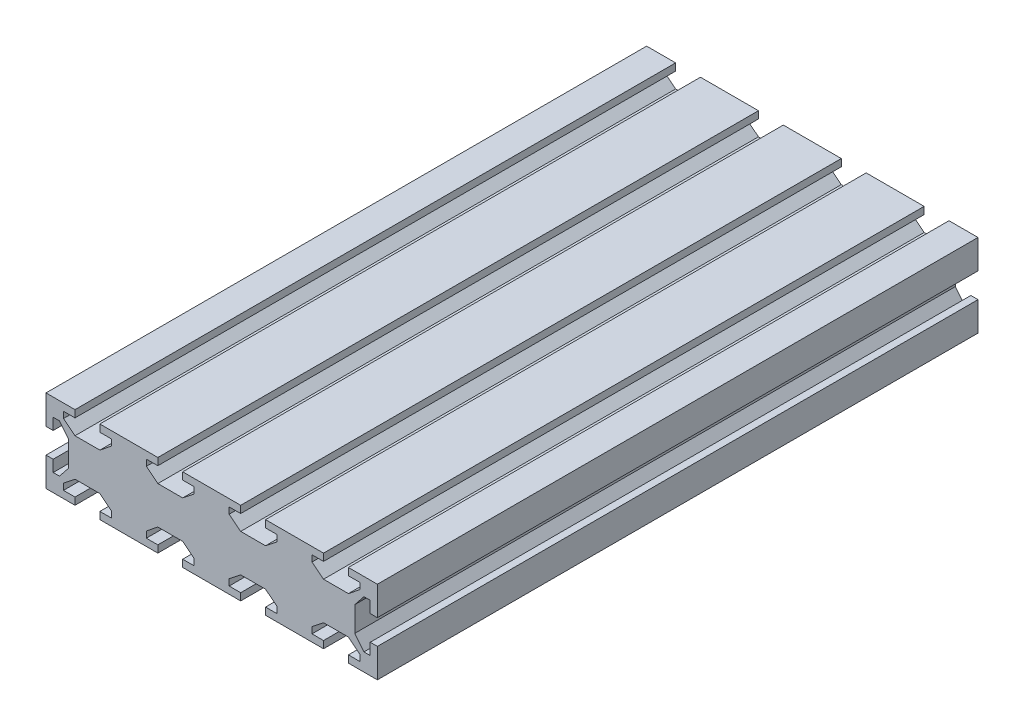
from build123d import *

# Parameters (mm, degrees)
BOSS_EXTRUDE1_DEPTH = 72.5


with BuildPart() as part:
    # Sketch1 → Boss-Extrude1 (new, symmetric)
    with BuildSketch(Plane.XY):
        Polygon((-10, 3), (-10, 10), (-3, 10), (-3, 8.27), (-5.78, 8.27), (-5.78, 6.75), (-3, 4.542263603), (3, 4.542263603), (5.78, 6.75), (5.78, 8.27), (3, 8.27), (3, 10), (10, 10), (17, 10), (17, 8.27), (14.22, 8.27), (14.22, 6.75), (17, 4.542263603), (23, 4.542263603), (25.78, 6.75), (25.78, 8.27), (23, 8.27), (23, 10), (30, 10), (37, 10), (37, 8.27), (34.22, 8.27), (34.22, 6.75), (37, 4.542263603), (43, 4.542263603), (45.78, 6.75), (45.78, 8.27), (43, 8.27), (43, 10), (50, 10), (57, 10), (57, 8.27), (54.22, 8.27), (54.22, 6.75), (57, 4.542263603), (63, 4.542263603), (65.78, 6.75), (65.78, 8.27), (63, 8.27), (63, 10), (70, 10), (70, 3), (68.27, 3), (68.27, 5.78), (66.75, 5.78), (64.542263603, 3), (64.542263603, -3), (66.75, -5.78), (68.27, -5.78), (68.27, -3), (70, -3), (70, -10), (63, -10), (63, -8.27), (65.78, -8.27), (65.78, -6.75), (63, -4.542263603), (57, -4.542263603), (54.22, -6.75), (54.22, -8.27), (57, -8.27), (57, -10), (50, -10), (43, -10), (43, -8.27), (45.78, -8.27), (45.78, -6.75), (43, -4.542263603), (37, -4.542263603), (34.22, -6.75), (34.22, -8.27), (37, -8.27), (37, -10), (30, -10), (23, -10), (23, -8.27), (25.78, -8.27), (25.78, -6.75), (23, -4.542263603), (17, -4.542263603), (14.22, -6.75), (14.22, -8.27), (17, -8.27), (17, -10), (10, -10), (3, -10), (3, -8.27), (5.78, -8.27), (5.78, -6.75), (3, -4.542263603), (-3, -4.542263603), (-5.78, -6.75), (-5.78, -8.27), (-3, -8.27), (-3, -10), (-10, -10), (-10, -3), (-8.27, -3), (-8.27, -5.78), (-6.75, -5.78), (-4.542263603, -3), (-4.542263603, 3), (-6.75, 5.78), (-8.27, 5.78), (-8.27, 3), align=None)
    extrude(amount=BOSS_EXTRUDE1_DEPTH, both=True)


solid = part.part
